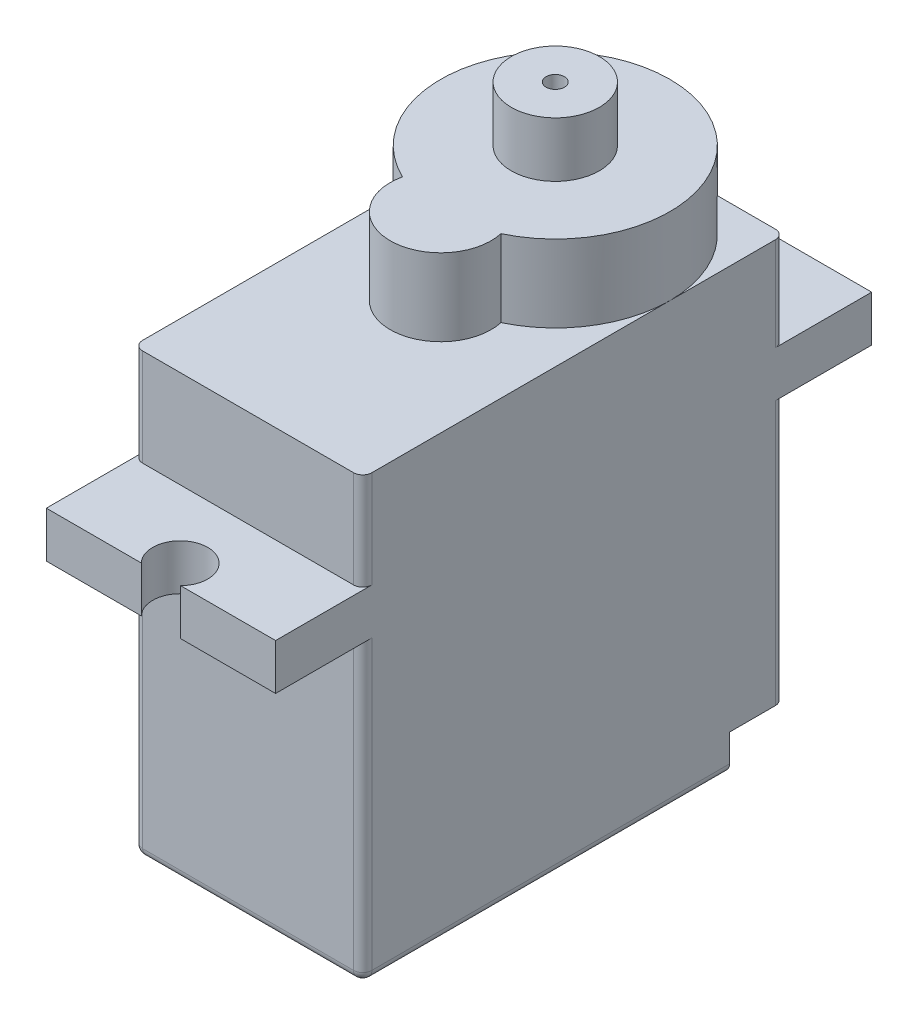
from build123d import *

# Parameters (mm, degrees)
SKETCH1_W               = 12.5
SKETCH1_H               = 23
BOSS_EXTRUDE1_DEPTH     = 24
BOSS_EXTRUDE2_DEPTH     = 4.2
SKETCH3_R               = 2.4
SKETCH3_R_2             = 0.5
BOSS_EXTRUDE3_DEPTH     = 3
SKETCH4_W               = 12.5
SKETCH4_H               = 2.5
BOSS_EXTRUDE4_DEPTH     = 4.75
SKETCH5_W               = 12.5
SKETCH5_H               = 2.5
BOSS_EXTRUDE5_DEPTH     = 4.75
CUT_EXTRUDE1_REACH      = 27.55
SKETCH6_R               = 1.5
CUT_EXTRUDE2_REACH      = 27.697
SKETCH8_R               = 1.5
CUT_EXTRUDE4_DEPTH      = 38.33299479
CUT_EXTRUDE6_DEPTH      = 38.33299479
CUT_EXTRUDE6_DEPTH_BACK = 2.3
CUT_EXTRUDE7_DEPTH      = 38.33299479
CUT_EXTRUDE7_DEPTH_BACK = 2.3
FILLET1_R               = 0.5


with BuildPart() as part:
    # Sketch1 → Boss-Extrude1 (new body)
    with BuildSketch(Plane(origin=(0, 0, 0), x_dir=(1, 0, 0), z_dir=(0, 1, 0))):
        Rectangle(SKETCH1_W, SKETCH1_H)
    extrude(amount=BOSS_EXTRUDE1_DEPTH)

    # Sketch2 → Boss-Extrude2 (add)
    with BuildSketch(Plane(origin=(0, 24, 0), x_dir=(1, 0, 0), z_dir=(0, 1, 0))):
        with BuildLine():
            ThreePointArc((2.682624648, -0.395), (0, 11.5), (-2.682624648, -0.395))
            ThreePointArc((-2.682624648, -0.395), (0, -3.75), (2.682624648, -0.395))
        make_face()
    extrude(amount=BOSS_EXTRUDE2_DEPTH)

    # Sketch3 → Boss-Extrude3 (add)
    with BuildSketch(Plane(origin=(0, 28.2, 0), x_dir=(1, 0, 0), z_dir=(0, 1, 0))):
        with Locations(Location((0, 5.25, 0), (0, 0, 270))):
            Circle(SKETCH3_R)
        with Locations(Location((0, 5.25, 0), (0, 0, 270))):
            Circle(SKETCH3_R_2, mode=Mode.SUBTRACT)
    extrude(amount=BOSS_EXTRUDE3_DEPTH)

    # Sketch4 → Boss-Extrude4 (add)
    with BuildSketch(Plane(origin=(0, 0, -11.5), x_dir=(-1, 0, 0), z_dir=(0, 0, -1))):
        with Locations((0, 17.65)):
            Rectangle(SKETCH4_W, SKETCH4_H)
    extrude(amount=BOSS_EXTRUDE4_DEPTH)

    # Sketch5 → Boss-Extrude5 (add)
    with BuildSketch(Plane.XY.offset(11.5)):
        with Locations((0, 17.45)):
            Rectangle(SKETCH5_W, SKETCH5_H)
    extrude(amount=BOSS_EXTRUDE5_DEPTH)

    # Sketch6 → Cut-Extrude1 (cut, up to next)
    with BuildSketch(Plane(origin=(0, 18.7, 0), x_dir=(1, 0, 0), z_dir=(0, 1, 0)), mode=Mode.PRIVATE) as cut_extrude1_sk1:
        with Locations((0, -15.2)):
            Circle(SKETCH6_R)
    cut_extrude1_tool1 = extrude(cut_extrude1_sk1.sketch, amount=-CUT_EXTRUDE1_REACH, mode=Mode.PRIVATE) & part.part
    add(cut_extrude1_tool1.solids().sort_by_distance((0, 18.7, 15.2))[0], mode=Mode.SUBTRACT)

    # Sketch8 → Cut-Extrude2 (cut, up to next)
    with BuildSketch(Plane(origin=(0, 18.9, 0), x_dir=(1, 0, 0), z_dir=(0, 1, 0)), mode=Mode.PRIVATE) as cut_extrude2_sk1:
        with Locations((0, 15.2)):
            Circle(SKETCH8_R)
    cut_extrude2_tool1 = extrude(cut_extrude2_sk1.sketch, amount=-CUT_EXTRUDE2_REACH, mode=Mode.PRIVATE) & part.part
    add(cut_extrude2_tool1.solids().sort_by_distance((0, 18.9, -15.2))[0], mode=Mode.SUBTRACT)

    # Sketch9 → Cut-Extrude4 (cut, through all)
    with BuildSketch(Plane(origin=(6.25, 0, 0), x_dir=(0, 0, -1), z_dir=(1, 0, 0))):
        Polygon((11.5, 2), (8.5, 0), (11.5, 0), align=None)
    extrude(amount=-CUT_EXTRUDE4_DEPTH, mode=Mode.SUBTRACT)

    # Sketch10 → Cut-Extrude6 (cut, two sides: drawn at the far end of the back side and taken through both)
    with BuildSketch(Plane(origin=(6.25, 0, 0), x_dir=(0, 0, -1), z_dir=(1, 0, 0)).offset(-CUT_EXTRUDE6_DEPTH_BACK)):
        Polygon((102.065563363, 2), (11.5, 2), (8.5, 2), (8.5, 0), (8.5, -90.565563363), (135.889097577, -219.33086493), (229.45466094, -126.765301567), align=None)
    extrude(amount=CUT_EXTRUDE6_DEPTH + CUT_EXTRUDE6_DEPTH_BACK, mode=Mode.SUBTRACT)

    # Sketch11 → Cut-Extrude7 (cut, two sides: drawn at the far end of the back side and taken through both)
    with BuildSketch(Plane.ZY.offset(6.25).offset(-CUT_EXTRUDE7_DEPTH_BACK)):
        Polygon((-102.065563363, 2), (-11.5, 2), (-8.5, 2), (-8.5, 0), (-8.5, -90.565563363), (-135.889097577, -219.33086493), (-229.45466094, -126.765301567), align=None)
    extrude(amount=CUT_EXTRUDE7_DEPTH + CUT_EXTRUDE7_DEPTH_BACK, mode=Mode.SUBTRACT)

    # Fillet1
    fillet1_edges = [part.edges().sort_by_distance(p)[0] for p in [
        (-6.25, 9.2, -11.5),
        (6.25, 9.2, -11.5),
        (6.25, 8.1, 11.5),
        (-6.25, 8.1, 11.5),
        (6.25, 0, 1.5),
        (0, 0, 11.5),
        (-6.25, 21.45, -11.5),
        (6.25, 21.45, -11.5),
        (6.25, 21.35, 11.5),
        (-6.25, 0, 1.5),
        (-6.25, 21.35, 11.5),
    ]]
    fillet(fillet1_edges, radius=FILLET1_R)


solid = part.part
